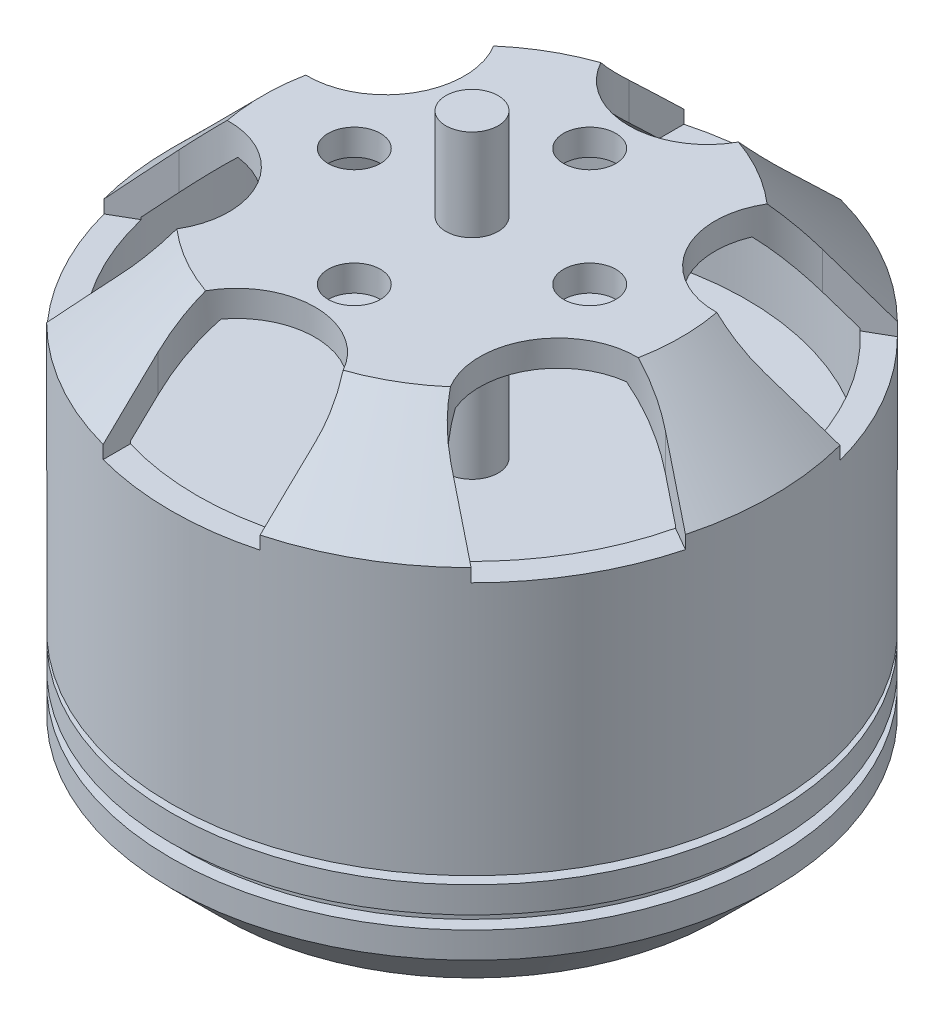
from build123d import *

# Parameters (mm, degrees)
SKETCH3_R          = 1
CUT_EXTRUDE2_DEPTH = 4
SKETCH6_R          = 1
CUT_EXTRUDE3_DEPTH = 3


with BuildPart() as part:
    # Sketch2 → Revolve1 (revolve)
    with BuildSketch(Plane.XY, mode=Mode.PRIVATE) as revolve1_sk:
        Polygon((0, 0), (1, 0), (1, 1.8), (9.5, 1.8), (11.5, 3.8), (11.5, 4.8), (11, 4.8), (11, 5.3), (11.5, 5.3), (11.5, 6.3), (9.5, 6.3), (9.5, 6.6), (11.5, 6.6), (11.5, 16.8), (8, 20.3), (1, 20.3), (1, 23.8), (0, 23.8), align=None)
        Polygon((2, 19.3), (7.585786438, 19.3), (10.5, 16.385786438), (10.5, 12.3), (1, 12.3), (1, 18.3), (2, 18.3), align=None, mode=Mode.SUBTRACT)
    revolve(revolve1_sk.sketch.rotate(Axis((0, 23.8, 0), (0, -1, 0)), 180), axis=Axis((0, 23.8, 0), (0, -1, 0)))

    # Sketch3 → Cut-Extrude2 (cut)
    with BuildSketch(Plane(origin=(0, 20.3, 0), x_dir=(1, 0, 0), z_dir=(0, 1, 0))):
        with Locations(Location((0, 4.5, 0), (0, 0, 180))):
            Circle(SKETCH3_R)
        with Locations(Location((4.5, 0, 0), (0, 0, 180))):
            Circle(SKETCH3_R)
        with Locations(Location((0, -4.5, 0), (0, 0, 180))):
            Circle(SKETCH3_R)
        with Locations(Location((-4.5, 0, 0), (0, 0, 180))):
            Circle(SKETCH3_R)
        with BuildLine():
            Line((-3, 9), (-3, 18.567871813))
            Line((-3, 18.567871813), (3, 18.567871813))
            Line((3, 18.567871813), (3, 9))
            ThreePointArc((3, 9), (0, 6), (-3, 9))
        make_face()
        with BuildLine():
            Line((6.294228634, 7.098076211), (14.580248685, 11.882012118))
            Line((14.580248685, 11.882012118), (17.580248685, 6.685859695))
            Line((17.580248685, 6.685859695), (9.294228634, 1.901923789))
            ThreePointArc((9.294228634, 1.901923789), (5.196152423, 3), (6.294228634, 7.098076211))
        make_face()
        with BuildLine():
            Line((9.294228634, -1.901923789), (17.580248685, -6.685859695))
            Line((17.580248685, -6.685859695), (14.580248685, -11.882012118))
            Line((14.580248685, -11.882012118), (6.294228634, -7.098076211))
            ThreePointArc((6.294228634, -7.098076211), (5.196152423, -3), (9.294228634, -1.901923789))
        make_face()
        with BuildLine():
            Line((3, -9), (3, -18.567871813))
            Line((3, -18.567871813), (-3, -18.567871813))
            Line((-3, -18.567871813), (-3, -9))
            ThreePointArc((-3, -9), (0, -6), (3, -9))
        make_face()
        with BuildLine():
            Line((-6.294228634, -7.098076211), (-14.580248685, -11.882012118))
            Line((-14.580248685, -11.882012118), (-17.580248685, -6.685859695))
            Line((-17.580248685, -6.685859695), (-9.294228634, -1.901923789))
            ThreePointArc((-9.294228634, -1.901923789), (-5.196152423, -3), (-6.294228634, -7.098076211))
        make_face()
        with BuildLine():
            Line((-9.294228634, 1.901923789), (-17.580248685, 6.685859695))
            Line((-17.580248685, 6.685859695), (-14.580248685, 11.882012118))
            Line((-14.580248685, 11.882012118), (-6.294228634, 7.098076211))
            ThreePointArc((-6.294228634, 7.098076211), (-5.196152423, 3), (-9.294228634, 1.901923789))
        make_face()
    extrude(amount=-CUT_EXTRUDE2_DEPTH, mode=Mode.SUBTRACT)

    # Sketch6 → Cut-Extrude3 (cut)
    with BuildSketch(Plane.XZ.offset(-1.8)):
        with Locations((0, 6)):
            Circle(SKETCH6_R)
        with Locations((8, 0)):
            Circle(SKETCH6_R)
        with Locations((0, -6)):
            Circle(SKETCH6_R)
        with Locations((-8, 0)):
            Circle(SKETCH6_R)
    extrude(amount=-CUT_EXTRUDE3_DEPTH, mode=Mode.SUBTRACT)


solid = part.part
